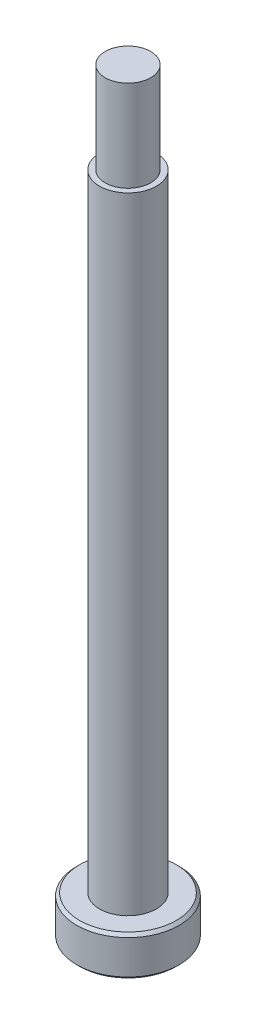
from build123d import *

# Parameters (mm, degrees)
SKETCH_1_R          = 4.5
EXTRUDE_1_DEPTH     = 3.5
SKETCH_2_R          = 2.5
EXTRUDE_2_DEPTH     = 55
SKETCH_3_R          = 2
EXTRUDE_3_DEPTH     = 8
CUT_EXTRUDE_1_DEPTH = 2.5
CHAMFER_1_SIZE      = 0.25


with BuildPart() as part:
    # 草图1 → 凸台-拉伸1 (new body)
    with BuildSketch(Plane(origin=(0, 0, 0), x_dir=(1, 0, 0), z_dir=(0, 1, 0))):
        with Locations(Location((0, 0, 0), (0, 0, 270))):
            Circle(SKETCH_1_R)
    extrude(amount=-EXTRUDE_1_DEPTH)

    # 草图2 → 凸台-拉伸2 (add)
    with BuildSketch(Plane(origin=(0, 0, 0), x_dir=(1, 0, 0), z_dir=(0, 1, 0))):
        with Locations(Location((0, 0, 0), (0, 0, 270))):
            Circle(SKETCH_2_R)
    extrude(amount=EXTRUDE_2_DEPTH)

    # 草图3 → 凸台-拉伸3 (add)
    with BuildSketch(Plane(origin=(0, 55, 0), x_dir=(1, 0, 0), z_dir=(0, 1, 0))):
        with Locations(Location((0, 0, 0), (0, 0, 270))):
            Circle(SKETCH_3_R)
    extrude(amount=EXTRUDE_3_DEPTH)

    # 草图4 → 切除-拉伸1 (cut)
    with BuildSketch(Plane.XZ.offset(3.5)):
        Polygon((1.5, -0.866025404), (1.5, 0.866025404), (0, 1.732050808), (-1.5, 0.866025404), (-1.5, -0.866025404), (0, -1.732050808), align=None)
    extrude(amount=-CUT_EXTRUDE_1_DEPTH, mode=Mode.SUBTRACT)

    # 倒角1
    chamfer_1_edges = [part.edges().sort_by_distance(p)[0] for p in [
        (0, 0, -4.5),
        (0, -3.5, -4.5),
    ]]
    chamfer(chamfer_1_edges, length=CHAMFER_1_SIZE)


solid = part.part
